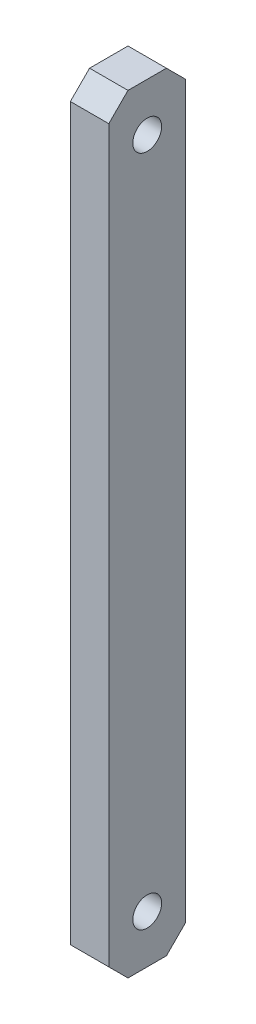
from build123d import *

# Parameters (mm, degrees)
SKETCH1_W           = 8
SKETCH1_H           = 80
SKETCH1_R           = 1.5
BOSS_EXTRUDE1_DEPTH = 4
CHAMFER1_SIZE       = 2


with BuildPart() as part:
    # Sketch1 → Boss-Extrude1 (new body)
    with BuildSketch(Plane(origin=(0, 0, 0), x_dir=(0, 0, -1), z_dir=(1, 0, 0))):
        Rectangle(SKETCH1_W, SKETCH1_H)
        with Locations((0, -35)):
            Circle(SKETCH1_R, mode=Mode.SUBTRACT)
        with Locations((0, 35)):
            Circle(SKETCH1_R, mode=Mode.SUBTRACT)
    extrude(amount=BOSS_EXTRUDE1_DEPTH)

    # Chamfer1
    chamfer1_edges = [part.edges().sort_by_distance(p)[0] for p in [
        (2, -40, -4),
        (2, -40, 4),
        (2, 40, 4),
        (2, 40, -4),
    ]]
    chamfer(chamfer1_edges, length=CHAMFER1_SIZE)


solid = part.part
